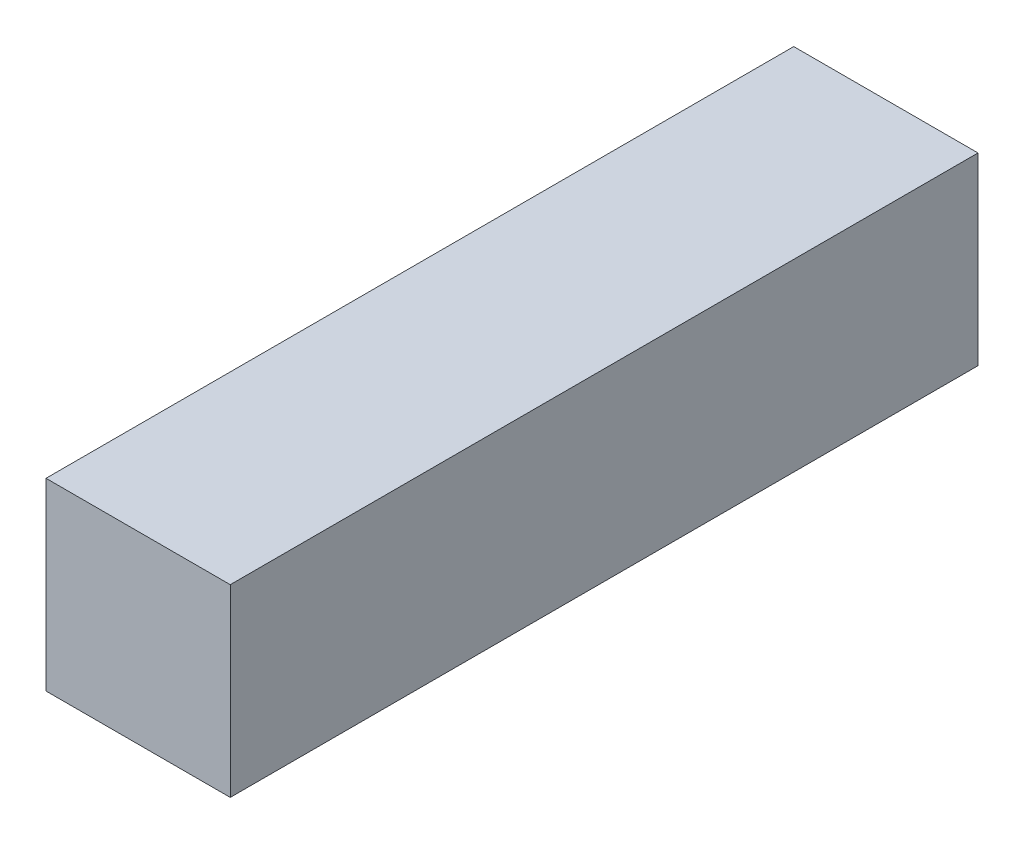
from build123d import *

# Parameters (mm, degrees)
SKETCH1_W           = 12.7
SKETCH1_H           = 12.7
BOSS_EXTRUDE1_DEPTH = 51.53914


with BuildPart() as part:
    # Sketch1 → Boss-Extrude1 (new body)
    with BuildSketch(Plane.XY):
        Rectangle(SKETCH1_W, SKETCH1_H)
    extrude(amount=BOSS_EXTRUDE1_DEPTH)


solid = part.part
